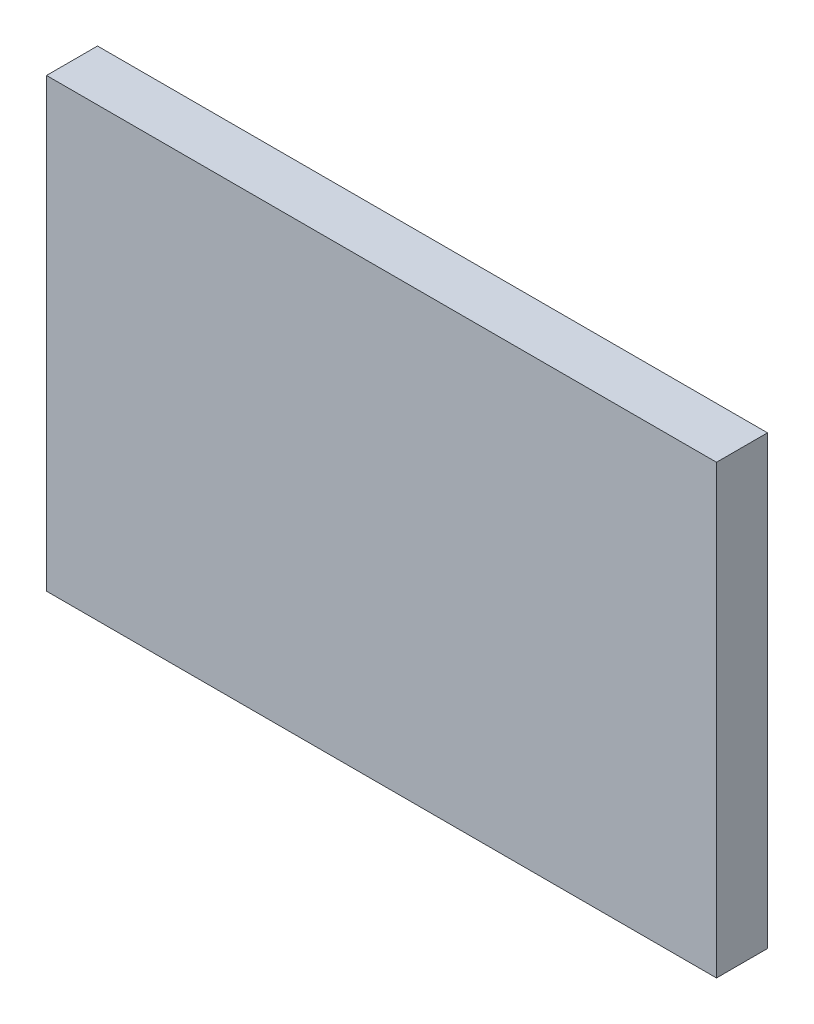
from build123d import *

# Parameters (mm, degrees)
CROQUIS1_W              = 38.1
CROQUIS1_H              = 25.4
SALIENTE_EXTRUIR1_DEPTH = 2.9


with BuildPart() as part:
    # Croquis1 → Saliente-Extruir1 (new body)
    with BuildSketch(Plane.XY):
        with Locations((19.05, -12.7)):
            Rectangle(CROQUIS1_W, CROQUIS1_H)
    extrude(amount=SALIENTE_EXTRUIR1_DEPTH)


solid = part.part
